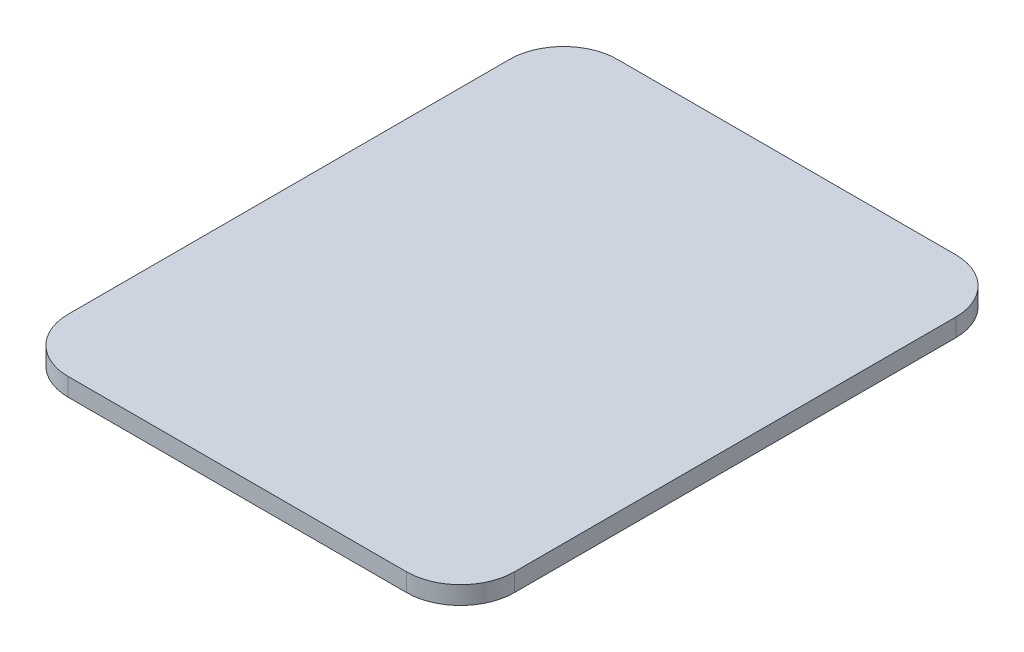
from build123d import *

# Parameters (mm, degrees)
BOSS_EXTRUDE1_DEPTH = 5


with BuildPart() as part:
    # Sketch2 → Boss-Extrude1 (new body)
    with BuildSketch(Plane(origin=(0, 0, 0), x_dir=(1, 0, 0), z_dir=(0, 1, 0))):
        with BuildLine():
            Line((-46.228873646, -76.706538448), (47.676126354, -76.706538448))
            ThreePointArc((47.676126354, -76.706538448), (58.2544438, -72.324855894), (62.636126354, -61.746538448))
            Line((62.636126354, -61.746538448), (62.636126354, 60.733461552))
            ThreePointArc((62.636126354, 60.733461552), (58.2544438, 71.311778999), (47.676126354, 75.693461552))
            Line((47.676126354, 75.693461552), (-46.228873646, 75.693461552))
            ThreePointArc((-46.228873646, 75.693461552), (-56.807191093, 71.311778999), (-61.188873646, 60.733461552))
            Line((-61.188873646, 60.733461552), (-61.188873646, -61.746538448))
            ThreePointArc((-61.188873646, -61.746538448), (-56.807191093, -72.324855894), (-46.228873646, -76.706538448))
        make_face()
    extrude(amount=BOSS_EXTRUDE1_DEPTH)


solid = part.part
